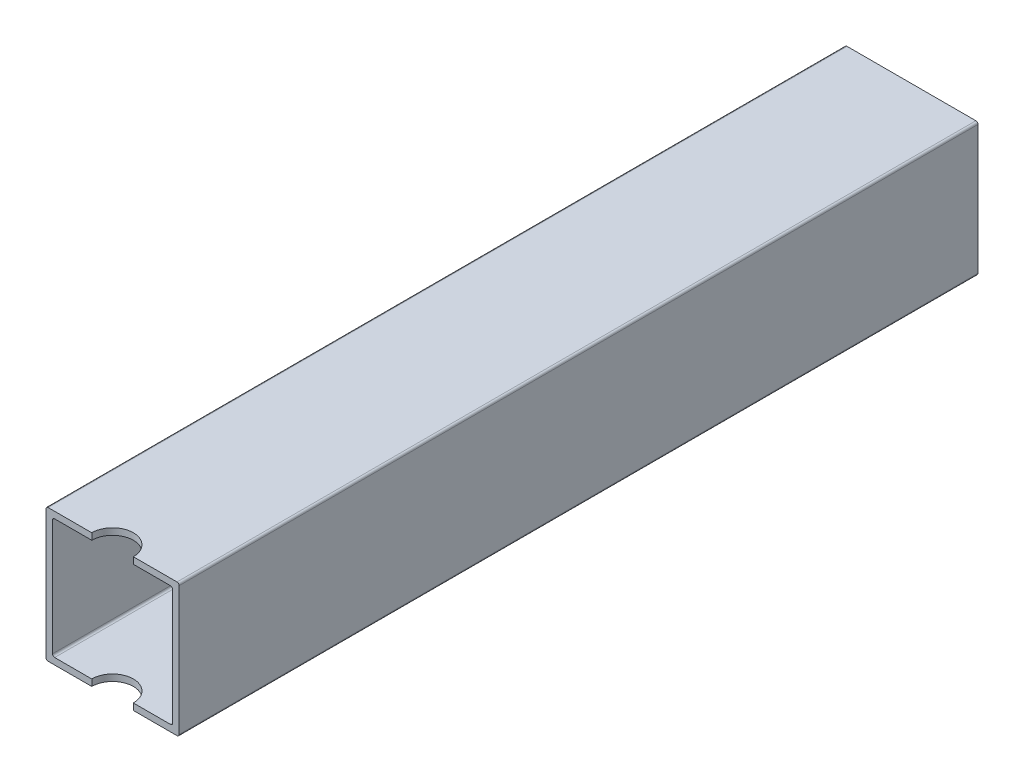
from build123d import *

# Parameters (mm, degrees)
SKETCH1_W           = 25.4
SKETCH1_H           = 25.4
SKETCH1_W_2         = 22.9108
SKETCH1_H_2         = 22.9108
BOSS_EXTRUDE1_DEPTH = 152.4
FILLET1_R           = 0.4064
FILLET2_R           = 0.4064
SKETCH2_R           = 3.96875
CUT_EXTRUDE1_DEPTH  = 157.576115675


with BuildPart() as part:
    # Sketch1 → Boss-Extrude1 (new body)
    with BuildSketch(Plane.XY):
        with Locations((12.7, 12.7)):
            Rectangle(SKETCH1_W, SKETCH1_H)
        with Locations((12.7, 12.7)):
            Rectangle(SKETCH1_W_2, SKETCH1_H_2, mode=Mode.SUBTRACT)
    extrude(amount=-BOSS_EXTRUDE1_DEPTH)

    # Fillet1
    fillet1_edges = [part.edges().sort_by_distance(p)[0] for p in [
        (0, 25.4, -76.2),
        (25.4, 25.4, -76.2),
        (25.4, 0, -76.2),
        (0, 0, -76.2),
    ]]
    fillet(fillet1_edges, radius=FILLET1_R)

    # Fillet2
    fillet2_edges = [part.edges().sort_by_distance(p)[0] for p in [
        (1.2446, 1.2446, -76.2),
        (1.2446, 24.1554, -76.2),
        (24.1554, 24.1554, -76.2),
        (24.1554, 1.2446, -76.2),
    ]]
    fillet(fillet2_edges, radius=FILLET2_R)

    # Sketch2 → Cut-Extrude1 (cut, through all)
    with BuildSketch(Plane(origin=(0, 25.4, 0), x_dir=(1, 0, 0), z_dir=(0, 1, 0))):
        with Locations((12.7, 0)):
            Circle(SKETCH2_R)
    extrude(amount=-CUT_EXTRUDE1_DEPTH, mode=Mode.SUBTRACT)


solid = part.part
